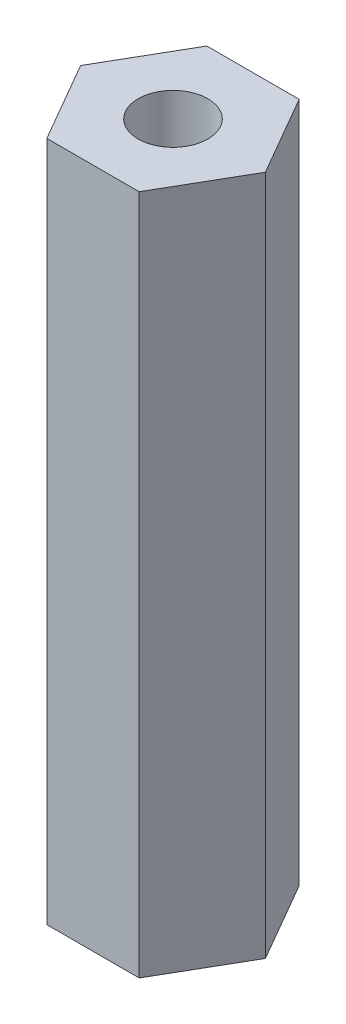
from build123d import *

# Parameters (mm, degrees)
BOSS_EXTRUDE1_DEPTH                = 20
TAP_DRILL_FOR_M2_5X0_45_TAP1_D     = 2.05
TAP_DRILL_FOR_M2_5X0_45_TAP1_DEPTH = 21


with BuildPart() as part:
    # Sketch1 → Boss-Extrude1 (new body)
    with BuildSketch(Plane(origin=(0, 20, 0), x_dir=(1, 0, 0), z_dir=(0, 1, 0))):
        Polygon((1.356773133, -2.35), (2.713546265, 0), (1.356773133, 2.35), (-1.356773133, 2.35), (-2.713546265, 0), (-1.356773133, -2.35), align=None)
    extrude(amount=-BOSS_EXTRUDE1_DEPTH)

    # Tap Drill for M2.5x0.45 Tap1
    with Locations(Plane(origin=(0, 20, 0), x_dir=(1, 0, 0), z_dir=(0, 1, 0))):
        with Locations((0, 0)):
            Hole(TAP_DRILL_FOR_M2_5X0_45_TAP1_D / 2, depth=TAP_DRILL_FOR_M2_5X0_45_TAP1_DEPTH)


solid = part.part
